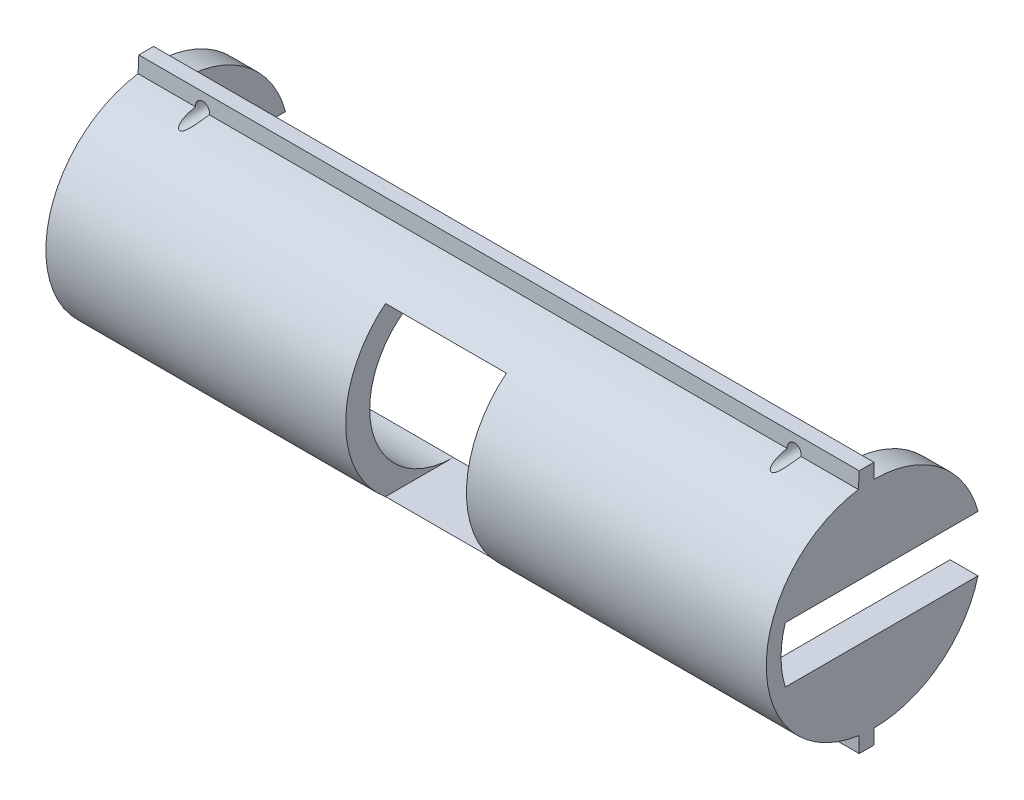
from build123d import *

# Parameters (mm, degrees)
BOSS_EXTRUDE1_DEPTH     = 155
CUT_EXTRUDE1_DEPTH      = 33.5
CUT_EXTRUDE2_START      = -33.5
CUT_EXTRUDE2_DEPTH      = 33.5
CUT_EXTRUDE3_DEPTH      = 166.346214426
CUT_EXTRUDE3_DEPTH_BACK = 166.346214426
SKETCH4_W               = 26
SKETCH4_H               = 36
CUT_EXTRUDE4_DEPTH      = 166.346214426
CUT_EXTRUDE4_DEPTH_BACK = 166.346214426
SKETCH5_R               = 1.5
BOSS_EXTRUDE2_START     = -6
BOSS_EXTRUDE2_DEPTH     = 6


with BuildPart() as part:
    # Sketch1 → Boss-Extrude1 (new body)
    with BuildSketch(Plane(origin=(0, 0, 0), x_dir=(0, 0, -1), z_dir=(1, 0, 0))):
        with BuildLine():
            Line((-6.678129735, 49.283191466), (-6.514064867, 52.7))
            Line((-6.514064867, 52.7), (-3.339064867, 52.7))
            Line((-3.339064867, 52.7), (-3.339064867, 44.35))
            ThreePointArc((-3.339064867, 44.35), (-21.339064867, 26.35), (-3.339064867, 8.35))
            Line((-3.339064867, 8.35), (-3.339064867, 0))
            Line((-3.339064867, 0), (-6.514064867, 0))
            Line((-6.514064867, 0), (-6.514064867, 3.393519434))
            ThreePointArc((-6.514064867, 3.393519434), (-26.513916757, 26.267145213), (-6.678129735, 49.283191466))
        make_face()
    extrude(amount=BOSS_EXTRUDE1_DEPTH)

    # Sketch2 → Cut-Extrude1 (cut)
    with BuildSketch(Plane(origin=(155, 0, 0), x_dir=(0, 0, -1), z_dir=(1, 0, 0))):
        with BuildLine():
            Line((-3.339064867, 46.35), (-3.339064867, 6.35))
            ThreePointArc((-3.339064867, 6.35), (-23.339064867, 26.35), (-3.339064867, 46.35))
        make_face()
    extrude(amount=-CUT_EXTRUDE1_DEPTH, mode=Mode.SUBTRACT)

    # Sketch3 → Cut-Extrude2 (cut)
    with BuildSketch(Plane.ZY.offset(CUT_EXTRUDE2_START)):
        with BuildLine():
            Line((3.339064867, 46.35), (3.339064867, 6.35))
            ThreePointArc((3.339064867, 6.35), (23.339064867, 26.35), (3.339064867, 46.35))
        make_face()
    extrude(amount=CUT_EXTRUDE2_DEPTH, mode=Mode.SUBTRACT)

    # Sketch4 → Cut-Extrude3 (cut, two sides: drawn at the far end of the back side and taken through both)
    with BuildSketch(Plane(origin=(0, 0, 3.339064867), x_dir=(-1, 0, 0), z_dir=(0, 0, -1)).offset(-CUT_EXTRUDE3_DEPTH_BACK)):
        with Locations((-77.5, 26.35)):
            Rectangle(SKETCH4_W, SKETCH4_H)
    extrude(amount=CUT_EXTRUDE3_DEPTH + CUT_EXTRUDE3_DEPTH_BACK, mode=Mode.SUBTRACT)

    # Sketch5 → Cut-Extrude4 (cut, two sides: drawn at the far end of the back side and taken through both)
    with BuildSketch(Plane(origin=(0, 0, 3.339064867), x_dir=(-1, 0, 0), z_dir=(0, 0, -1)).offset(-CUT_EXTRUDE4_DEPTH_BACK)):
        with Locations((-141.15, 49.525)):
            Circle(SKETCH5_R)
        with Locations((-141.15, 3.175)):
            Circle(SKETCH5_R)
        with Locations((-13.85, 49.525)):
            Circle(SKETCH5_R)
        with Locations((-13.85, 3.175)):
            Circle(SKETCH5_R)
    extrude(amount=CUT_EXTRUDE4_DEPTH + CUT_EXTRUDE4_DEPTH_BACK, mode=Mode.SUBTRACT)

    # Sketch6 → Boss-Extrude2 (add)
    with BuildSketch(Plane(origin=(155, 0, 0), x_dir=(0, 0, -1), z_dir=(1, 0, 0)).offset(BOSS_EXTRUDE2_START)):
        with BuildLine():
            Line((-25.72389511, 32.35), (19.045765375, 32.35))
            ThreePointArc((19.045765375, 32.35), (-3.339064867, 49.525), (-25.72389511, 32.35))
        make_face()
        with BuildLine():
            Line((-25.72389511, 20.35), (19.045765375, 20.35))
            ThreePointArc((19.045765375, 20.35), (-3.339064867, 3.175), (-25.72389511, 20.35))
        make_face()
    boss_extrude2 = extrude(amount=BOSS_EXTRUDE2_DEPTH)

    # Mirror1: Boss-Extrude2 across plane
    add(boss_extrude2.mirror(Plane(origin=(77.5, 0, 0), x_dir=(0, 0, 1), z_dir=(1, 0, 0))))


solid = part.part
